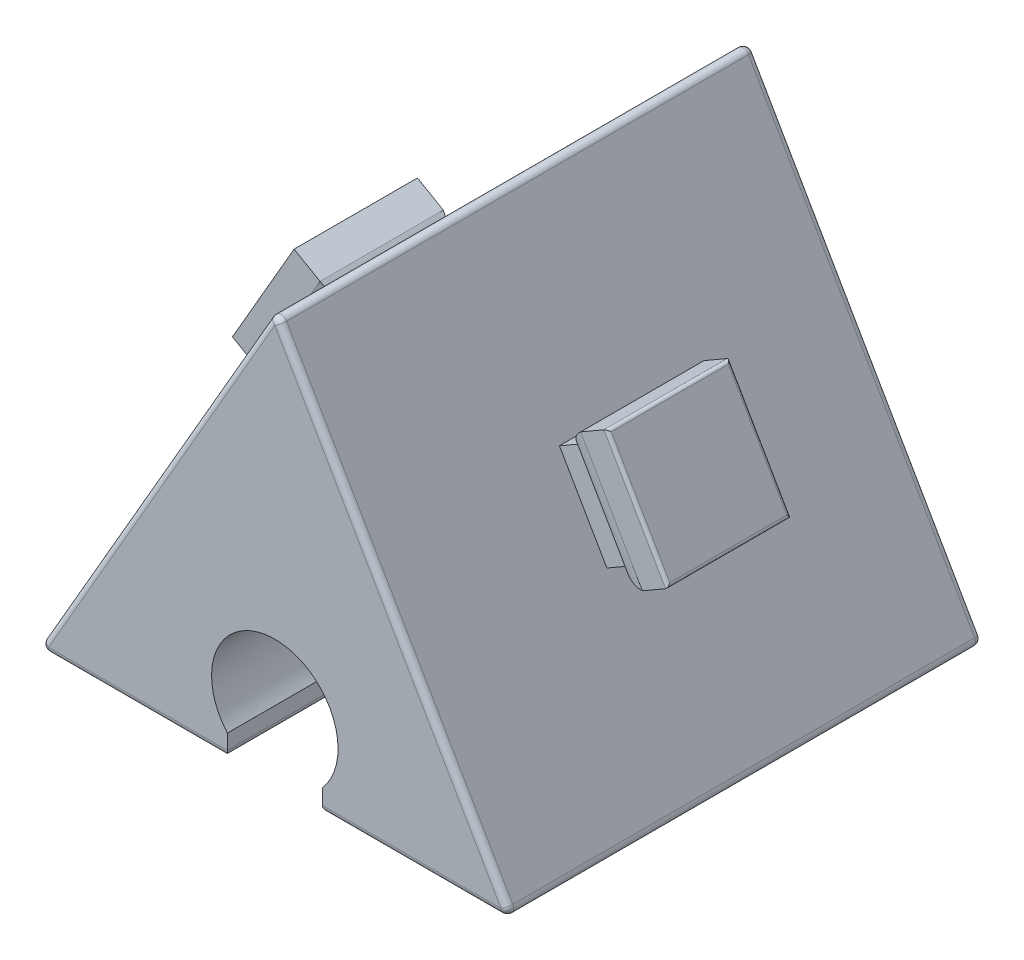
from build123d import *

# Parameters (mm, degrees)
EXTRUDE_1_DEPTH        = 7.5
EXTRUDE_1_DEPTH_BACK   = 7.5
CUT_EXTRUDE_1_REACH    = 23.213
EXTRUDE_2_DEPTH        = 2
EXTRUDE_2_DEPTH_BACK   = 2
EXTRUDE_2_2_DEPTH      = 2
EXTRUDE_2_2_DEPTH_BACK = 2
EXTRUDE_4_DEPTH        = 1.5
CUT_EXTRUDE_2_DEPTH    = 17.046494944
FILLET_1_R             = 0.1
FILLET_2_R             = 0.2
CUT_EXTRUDE_3_REACH    = 17.828


with BuildPart() as part:
    # 草图1 → 凸台-拉伸1 (new, two sides: drawn at the far end of the back side and taken through both)
    with BuildSketch(Plane.XY.offset(-EXTRUDE_1_DEPTH_BACK)):
        Polygon((-7.5, 0), (0, 12.990381057), (7.5, 0), align=None)
    extrude(amount=EXTRUDE_1_DEPTH + EXTRUDE_1_DEPTH_BACK)

    # 草图2 → 切除-拉伸1 (cut, up to next)
    with BuildSketch(Plane.XY.offset(7.5), mode=Mode.PRIVATE) as cut_extrude_1_sk1:
        with BuildLine():
            Line((-1.5, 0.677124344), (-1.5, 0))
            Line((-1.5, 0), (1.5, 0))
            Line((1.5, 0), (1.5, 0.677124344))
            ThreePointArc((1.5, 0.677124344), (0, 4), (-1.5, 0.677124344))
        make_face()
    cut_extrude_1_tool1 = extrude(cut_extrude_1_sk1.sketch, amount=-CUT_EXTRUDE_1_REACH, mode=Mode.PRIVATE) & part.part
    add(cut_extrude_1_tool1.solids().sort_by_distance((0, 1.914707, 7.5))[0], mode=Mode.SUBTRACT)



with BuildPart() as body_2:
    # 草图3 → 凸台-拉伸2 (new, two sides: drawn at the far end of the back side and taken through both)
    with BuildSketch(Plane.XY.offset(-EXTRUDE_2_DEPTH_BACK)):
        with BuildLine():
            Line((3.586406884, 8.132790806), (5.086406884, 5.534714595))
            ThreePointArc((5.086406884, 5.534714595), (5.582396677, 5.497709438), (6.0721807, 5.584236131))
            Line((6.0721807, 5.584236131), (6.890063509, 6.056440991))
            Line((6.890063509, 6.056440991), (5.915063509, 7.745190528))
            Line((5.915063509, 7.745190528), (4.940063509, 9.433940066))
            Line((4.940063509, 9.433940066), (4.1221807, 8.961735205))
            ThreePointArc((4.1221807, 8.961735205), (3.802354375, 8.580833146), (3.586406884, 8.132790806))
        make_face()
    extrude(amount=EXTRUDE_2_DEPTH + EXTRUDE_2_DEPTH_BACK)


with BuildPart() as body_3:
    # 草图3 → Extrude 2 2 (new, two sides: drawn at the far end of the back side and taken through both)
    with BuildSketch(Plane.XY.offset(-EXTRUDE_2_2_DEPTH_BACK)):
        with BuildLine():
            Line((-4.940063509, 9.433940066), (-4.1221807, 8.961735205))
            ThreePointArc((-4.1221807, 8.961735205), (-3.802354375, 8.580833146), (-3.586406884, 8.132790806))
            Line((-3.586406884, 8.132790806), (-5.086406884, 5.534714595))
            ThreePointArc((-5.086406884, 5.534714595), (-5.582396677, 5.497709438), (-6.0721807, 5.584236131))
            Line((-6.0721807, 5.584236131), (-6.890063509, 6.056440991))
            Line((-6.890063509, 6.056440991), (-5.915063509, 7.745190528))
            Line((-5.915063509, 7.745190528), (-4.940063509, 9.433940066))
        make_face()
    extrude(amount=EXTRUDE_2_2_DEPTH + EXTRUDE_2_2_DEPTH_BACK)

    # 切除-拉伸3: up to this face of the body (flat: up to its plane)
    cut_extrude_3_end = Plane(body_3.part.faces().sort_by_distance((-4.531122105, 9.197837636, 0))[0])
    # 草图7 → 切除-拉伸3 (cut, up to the picked face)
    with BuildSketch(Plane(origin=(0.9, 1.558845727, 0), x_dir=(0.8660254037844376, -0.5000000000000019, 0), z_dir=(-0.5000000000000019, -0.8660254037844376, 0)), mode=Mode.PRIVATE) as cut_extrude_3_sk1:
        with BuildLine():
            Line((-8.995190528, 2), (-7.172314873, 2))
            Line((-7.172314873, 2), (-7.172314873, 1.5))
            ThreePointArc((-7.172314873, 1.5), (-7.583352056, 1.780042303), (-8.050780808, 1.95))
            Line((-8.050780808, 1.95), (-8.995190528, 1.95))
            Line((-8.995190528, 1.95), (-8.995190528, 2))
        make_face()
    cut_extrude_3_tool1 = split(extrude(cut_extrude_3_sk1.sketch, amount=-CUT_EXTRUDE_3_REACH, mode=Mode.PRIVATE), bisect_by=cut_extrude_3_end, keep=Keep.BOTH, mode=Mode.PRIVATE)
    # 草图7 → 切除-拉伸3 (cut, up to the picked face)
    with BuildSketch(Plane(origin=(0.9, 1.558845727, 0), x_dir=(0.8660254037844376, -0.5000000000000019, 0), z_dir=(-0.5000000000000019, -0.8660254037844376, 0)), mode=Mode.PRIVATE) as cut_extrude_3_sk2:
        with BuildLine():
            Line((-8.995190528, -2), (-7.172314873, -2))
            Line((-7.172314873, -2), (-7.172314873, -1.5))
            ThreePointArc((-7.172314873, -1.5), (-7.583352056, -1.780042303), (-8.050780808, -1.95))
            Line((-8.050780808, -1.95), (-8.995190528, -1.95))
            Line((-8.995190528, -1.95), (-8.995190528, -2))
        make_face()
    cut_extrude_3_tool2 = split(extrude(cut_extrude_3_sk2.sketch, amount=-CUT_EXTRUDE_3_REACH, mode=Mode.PRIVATE), bisect_by=cut_extrude_3_end, keep=Keep.BOTH, mode=Mode.PRIVATE)
    add(cut_extrude_3_tool1.solids().sort_by(Axis((-5.742645, 5.393979, 1.873038), (0.5000000000000019, 0.8660254037844376, 0)))[0], mode=Mode.SUBTRACT)
    add(cut_extrude_3_tool2.solids().sort_by(Axis((-5.742645, 5.393979, -1.873038), (0.5000000000000019, 0.8660254037844376, 0)))[0], mode=Mode.SUBTRACT)


with BuildPart() as part_1:
    add(part.part)

    add(body_2.part)  # 凸台-拉伸4 merges body 2
    # 草图5 → 凸台-拉伸4 (add, symmetric)
    with BuildSketch(Plane.XY):
        Polygon((3.586406884, 8.132790806), (5.086406884, 5.534714595), (4.5, 5.196152423), (3, 7.794228634), align=None)
    extrude_4 = extrude(amount=EXTRUDE_4_DEPTH, both=True)

    # 草图6 → 切除-拉伸2 (cut, through all)
    with BuildSketch(Plane(origin=(-0.9, 1.558845727, 0), x_dir=(0.8660254037844376, 0.5000000000000019, 0), z_dir=(0.5000000000000019, -0.8660254037844376, 0))):
        with BuildLine():
            Line((8.995190528, -2), (8.995190528, -1.95))
            Line((8.995190528, -1.95), (8.050780808, -1.95))
            ThreePointArc((8.050780808, -1.95), (7.583352056, -1.780042303), (7.172314873, -1.5))
            Line((7.172314873, -1.5), (7.172314873, -2))
            Line((7.172314873, -2), (8.995190528, -2))
        make_face()
        with BuildLine():
            Line((8.995190528, 1.95), (8.050780808, 1.95))
            ThreePointArc((8.050780808, 1.95), (7.583352056, 1.780042303), (7.172314873, 1.5))
            Line((7.172314873, 1.5), (7.172314873, 2))
            Line((7.172314873, 2), (8.995190528, 2))
            Line((8.995190528, 2), (8.995190528, 1.95))
        make_face()
    extrude(amount=-CUT_EXTRUDE_2_DEPTH, mode=Mode.SUBTRACT)

    # 圆角1
    fillet_1_edges = [part_1.edges().sort_by_distance(p)[0] for p in [
        (5.915063509, 7.745190528, 1.95),
        (6.890063509, 6.056440991, 0),
        (4.940063509, 9.433940066, 0),
        (5.915063509, 7.745190528, -1.95),
    ]]
    fillet(fillet_1_edges, radius=FILLET_1_R)

    # 圆角2
    fillet_2_edges = [part_1.edges().sort_by_distance(p)[0] for p in [
        (-3.75, 6.495190528, -7.5),
        (3.75, 6.495190528, 7.5),
        (-3.75, 6.495190528, 7.5),
        (4.5, 0, 7.5),
        (4.5, 0, -7.5),
        (1.5, 0, 0),
        (-1.5, 0, 0),
        (-4.5, 0, -7.5),
        (-7.5, 0, 0),
        (0, 12.990381057, 0),
        (7.5, 0, 0),
        (3.75, 6.495190528, -7.5),
        (-4.5, 0, 7.5),
    ]]
    fillet(fillet_2_edges, radius=FILLET_2_R)

    # 镜向9: 凸台-拉伸4 across plane
    add(extrude_4.mirror(Plane(origin=(0, 0, 0), x_dir=(0, 0, 1), z_dir=(1, 0, 0))))


solid = Compound([body_3.part, part_1.part])
